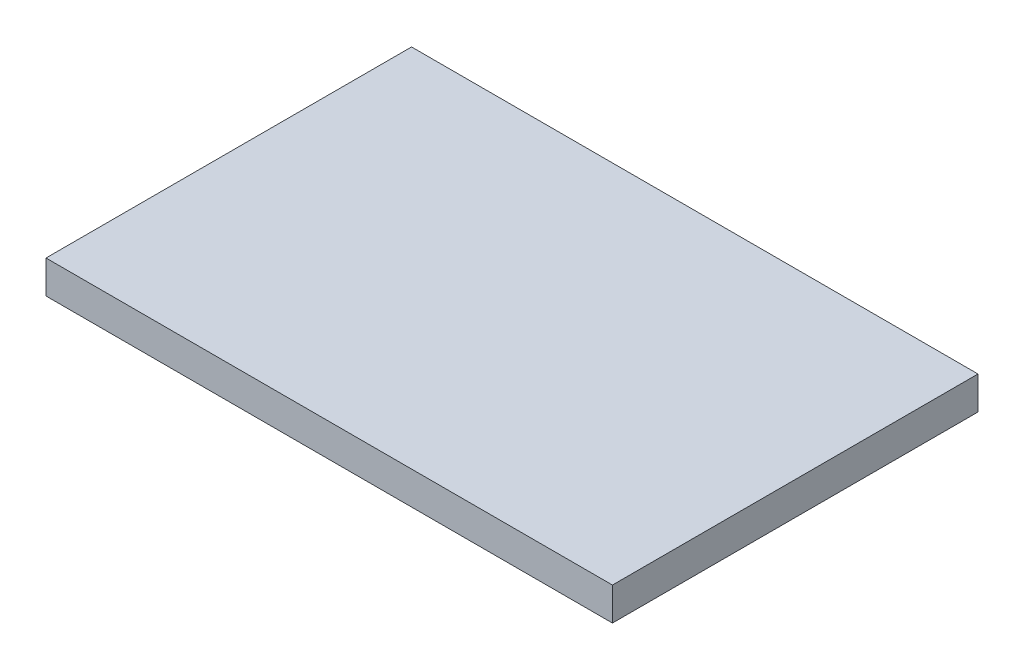
from build123d import *

# Parameters (mm, degrees)
SKETCH1_W           = 17.2
SKETCH1_H           = 11.1
BOSS_EXTRUDE1_DEPTH = 1


with BuildPart() as part:
    # Sketch1 → Boss-Extrude1 (new body)
    with BuildSketch(Plane(origin=(0, 0, 0), x_dir=(1, 0, 0), z_dir=(0, 1, 0))):
        with Locations((8.6, -5.55)):
            Rectangle(SKETCH1_W, SKETCH1_H)
    extrude(amount=BOSS_EXTRUDE1_DEPTH)


solid = part.part
